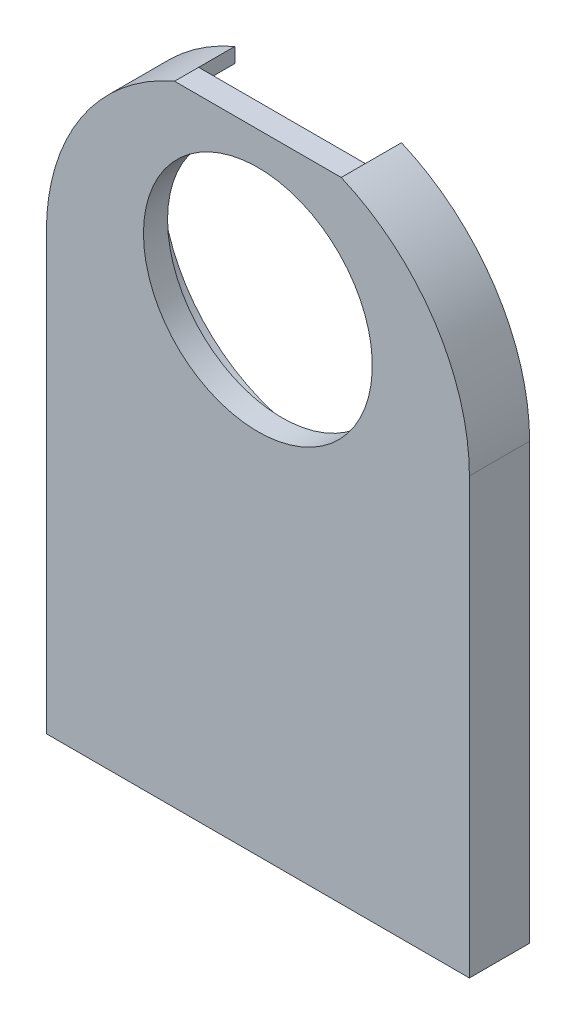
from build123d import *

# Parameters (mm, degrees)
BOSS_EXTRUDE1_DEPTH = 1.5
BOSS_EXTRUDE2_DEPTH = 1
SKETCH4_R           = 4.75
CUT_EXTRUDE1_DEPTH  = 23.898325822
SKETCH5_W           = 17.56
SKETCH5_H           = 2.5
BOSS_EXTRUDE3_DEPTH = 0.15
SKETCH6_W           = 17.56
SKETCH6_H           = 2.5
BOSS_EXTRUDE4_DEPTH = 11.35


with BuildPart() as part:
    # Sketch1 → Boss-Extrude1 (new body)
    with BuildSketch(Plane.XY):
        with BuildLine():
            ThreePointArc((14.980604809, 6.55), (8.78, 2), (2.579395191, 6.55))
            Line((2.579395191, 6.55), (0, 6.55))
            Line((0, 6.55), (0, 0))
            Line((0, 0), (17.56, 0))
            Line((17.56, 0), (17.56, 6.55))
            Line((17.56, 6.55), (14.980604809, 6.55))
        make_face()
        with BuildLine():
            ThreePointArc((2.579395191, 6.55), (2.679421093, 10.743420825), (5.32, 14.002581212))
            Line((5.32, 14.002581212), (5.32, 14.619498126))
            ThreePointArc((5.32, 14.619498126), (1.449679407, 11.382680416), (0, 6.55))
            Line((0, 6.55), (2.579395191, 6.55))
        make_face()
        with BuildLine():
            ThreePointArc((12.24, 14.002581212), (14.880578907, 10.743420825), (14.980604809, 6.55))
            Line((14.980604809, 6.55), (17.56, 6.55))
            ThreePointArc((17.56, 6.55), (16.110320593, 11.382680416), (12.24, 14.619498126))
            Line((12.24, 14.619498126), (12.24, 14.002581212))
        make_face()
    extrude(amount=BOSS_EXTRUDE1_DEPTH)

    # Sketch3 → Boss-Extrude2 (add)
    with BuildSketch(Plane.XY.offset(1.5)):
        with BuildLine():
            Line((12.24, 14.619498126), (12.24, 14.002581212))
            ThreePointArc((12.24, 14.002581212), (8.78, 2), (5.32, 14.002581212))
            Line((5.32, 14.002581212), (5.32, 14.619498126))
            ThreePointArc((5.32, 14.619498126), (1.449679407, 11.382680416), (0, 6.55))
            Line((0, 6.55), (0, 0))
            Line((0, 0), (17.56, 0))
            Line((17.56, 0), (17.56, 6.55))
            ThreePointArc((17.56, 6.55), (16.110320593, 11.382680416), (12.24, 14.619498126))
        make_face()
        with BuildLine():
            Line((5.32, 14.619498126), (12.24, 14.619498126))
            Line((12.24, 14.619498126), (12.24, 14.002581212))
            ThreePointArc((12.24, 14.002581212), (8.78, 2), (5.32, 14.002581212))
            Line((5.32, 14.002581212), (5.32, 14.619498126))
        make_face()
    extrude(amount=BOSS_EXTRUDE2_DEPTH)

    # Sketch4 → Cut-Extrude1 (cut, through all)
    with BuildSketch(Plane(origin=(0, 0, 1.5), x_dir=(-1, 0, 0), z_dir=(0, 0, -1))):
        with Locations((-8.78, 8.5)):
            Circle(SKETCH4_R)
    extrude(amount=-CUT_EXTRUDE1_DEPTH, mode=Mode.SUBTRACT)

    # Sketch5 → Boss-Extrude3 (add)
    with BuildSketch(Plane.XZ):
        with Locations((8.78, 1.25)):
            Rectangle(SKETCH5_W, SKETCH5_H)
    extrude(amount=BOSS_EXTRUDE3_DEPTH)

    # Sketch6 → Boss-Extrude4 (add)
    with BuildSketch(Plane.XZ.offset(0.15)):
        with Locations((8.78, 1.25)):
            Rectangle(SKETCH6_W, SKETCH6_H)
    extrude(amount=BOSS_EXTRUDE4_DEPTH)


solid = part.part
